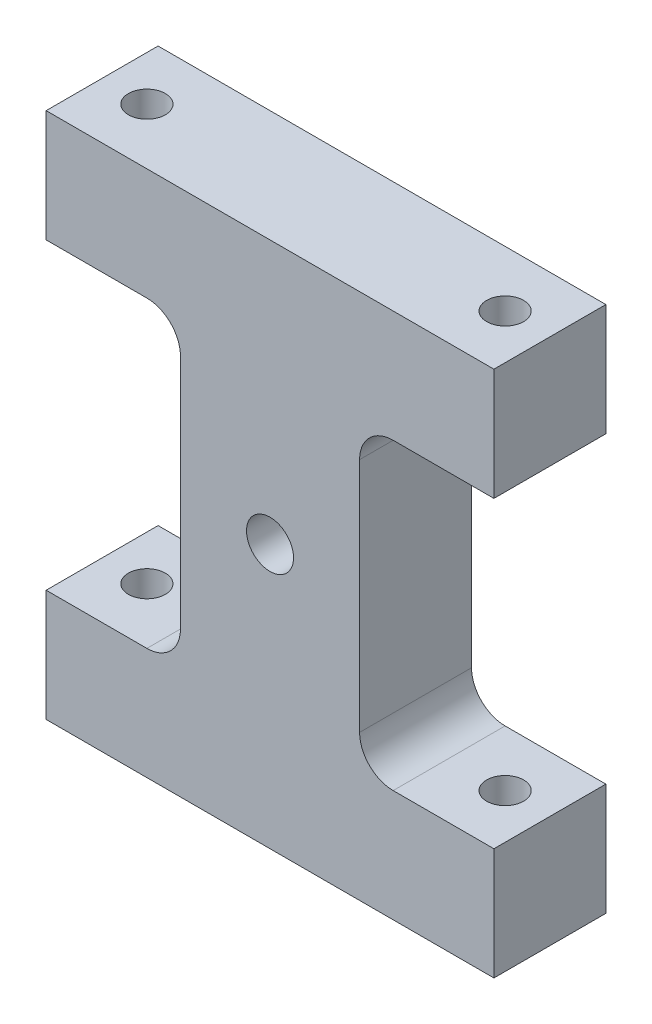
from build123d import *

# Parameters (mm, degrees)
SKETCH_1_W                  = 40
SKETCH_1_H                  = 47.1
EXTRUDE_1_DEPTH             = 10
HOLE_WIZARD_M4_1_AT_2_COUNT = 2
HOLE_WIZARD_M4_1_AT_2_PITCH = 32
HOLE_WIZARD_M5_1_D          = 4.2
HOLE_WIZARD_M5_1_DEPTH      = 12.4
HOLE_WIZARD_M5_1_TIP        = 1.2618073
CUT_EXTRUDE_1_REACH         = 34.475
SKETCH_8_W                  = 24
SKETCH_8_H                  = 27.1
FILLET_1_R                  = 3


with BuildPart() as part:
    # 草图1 → 凸台-拉伸1 (new body)
    with BuildSketch(Plane.XY):
        Rectangle(SKETCH_1_W, SKETCH_1_H)
    extrude(amount=EXTRUDE_1_DEPTH)

    # 草图4 → M4 螺纹孔1 (revolve, cut)
    with BuildSketch(Plane(origin=(-16, 23.55, 5), x_dir=(0, 0, 1), z_dir=(1, 0, 0))):
        Polygon((0, 0), (0, 11.091420021), (1.65, 10.1), (1.65, 0), align=None)
    hole_wizard_m4_1 = revolve(axis=Axis((-16, 29.9, 5), (0, -1, 0)), mode=Mode.SUBTRACT)

    # M4 螺纹孔1 at 2: M4 螺纹孔1 ×2
    with Locations(*[(i * HOLE_WIZARD_M4_1_AT_2_PITCH, 0, 0) for i in range(1, HOLE_WIZARD_M4_1_AT_2_COUNT)]):
        add(hole_wizard_m4_1, mode=Mode.SUBTRACT)

    # 镜向1: M4 螺纹孔1 across plane
    add(hole_wizard_m4_1.mirror(Plane.ZX), mode=Mode.SUBTRACT)

    # 镜向1 copy 1 sketch → 镜向1 copy 1 (revolve, cut)
    with BuildSketch(Plane(origin=(16, -23.55, 5), x_dir=(0, 0, 1), z_dir=(1, 0, 0))):
        Polygon((0, 0), (0, -11.091420021), (1.65, -10.1), (1.65, 0), align=None)
    revolve(axis=Axis((16, -29.9, 5), (0, -1, 0)), mode=Mode.SUBTRACT)

    # M5 螺纹孔1
    with Locations(Plane.XY.offset(10)):
        with Locations((0, 0)):
            Hole(HOLE_WIZARD_M5_1_D / 2, depth=HOLE_WIZARD_M5_1_DEPTH)
            with Locations((0, 0, -(HOLE_WIZARD_M5_1_DEPTH + HOLE_WIZARD_M5_1_TIP / 2))):  # 118° drill point
                Cone(0, HOLE_WIZARD_M5_1_D / 2, HOLE_WIZARD_M5_1_TIP, mode=Mode.SUBTRACT)

    # 切除-拉伸1: up to this face of the body (flat: up to its plane)
    cut_extrude_1_end = Plane(part.part.faces().sort_by_distance((0, -22.932067156, 0))[0])
    # 草图8 → 切除-拉伸1 (cut, up to the picked face)
    with BuildSketch(Plane.XY.offset(10), mode=Mode.PRIVATE) as cut_extrude_1_sk1:
        with Locations((20, 0)):
            Rectangle(SKETCH_8_W, SKETCH_8_H)
    cut_extrude_1_tool1 = split(extrude(cut_extrude_1_sk1.sketch, amount=-CUT_EXTRUDE_1_REACH, mode=Mode.PRIVATE), bisect_by=cut_extrude_1_end, keep=Keep.BOTH, mode=Mode.PRIVATE)
    cut_extrude_1 = cut_extrude_1_tool1.solids().sort_by(Axis((20, 0, 10), (0, 0, -1)))[0]
    add(cut_extrude_1, mode=Mode.SUBTRACT)

    # 镜向2: 切除-拉伸1 across plane
    add(cut_extrude_1.mirror(Plane(origin=(0, 0, 0), x_dir=(0, 0, 1), z_dir=(1, 0, 0))), mode=Mode.SUBTRACT)

    # 圆角1
    fillet_1_edges = [part.edges().sort_by_distance(p)[0] for p in [
        (8, 13.55, 5),
        (8, -13.55, 5),
        (-8, -13.55, 5),
        (-8, 13.55, 5),
    ]]
    fillet(fillet_1_edges, radius=FILLET_1_R)


solid = part.part
